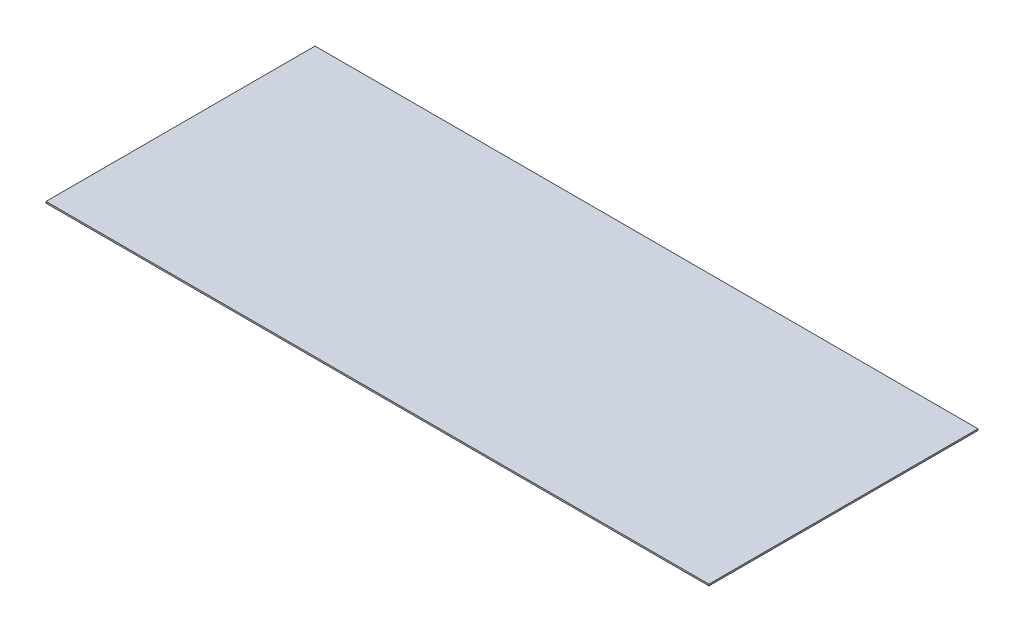
from build123d import *

# Parameters (mm, degrees)
SKETCH1_W           = 1346.708
SKETCH1_H           = 546.608
BOSS_EXTRUDE1_DEPTH = 3.175


with BuildPart() as part:
    # Sketch1 → Boss-Extrude1 (new body)
    with BuildSketch(Plane(origin=(0, 0, 0), x_dir=(1, 0, 0), z_dir=(0, 1, 0))):
        Rectangle(SKETCH1_W, SKETCH1_H)
    extrude(amount=BOSS_EXTRUDE1_DEPTH)


solid = part.part
